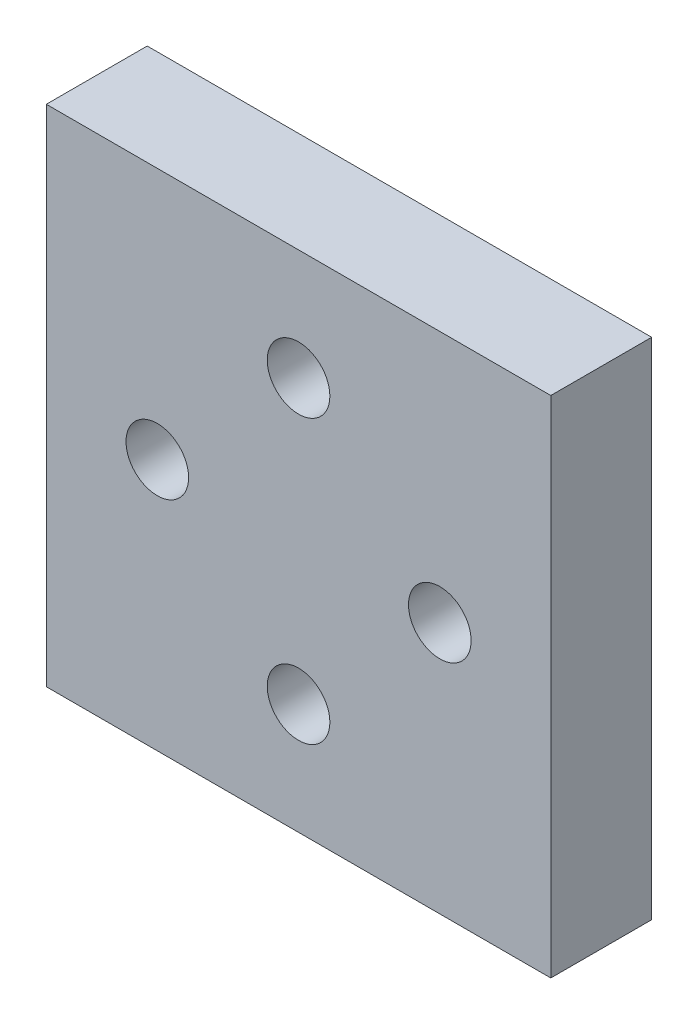
from build123d import *

# Parameters (mm, degrees)
SKETCH1_W           = 25
SKETCH1_H           = 25
SKETCH1_R           = 1.5
SKETCH1_R_2         = 1.551537049
BOSS_EXTRUDE1_DEPTH = 5
SKETCH2_R           = 1.55
BOSS_EXTRUDE2_DEPTH = 5


with BuildPart() as part:
    # Sketch1 → Boss-Extrude1 (new body)
    with BuildSketch(Plane.XY):
        Rectangle(SKETCH1_W, SKETCH1_H)
        Circle(SKETCH1_R, mode=Mode.SUBTRACT)
        with Locations((0, 7)):
            Circle(SKETCH1_R_2, mode=Mode.SUBTRACT)
        with Locations((7, 0)):
            Circle(SKETCH1_R_2, mode=Mode.SUBTRACT)
        with Locations((0, -7)):
            Circle(SKETCH1_R_2, mode=Mode.SUBTRACT)
        with Locations((-7, 0)):
            Circle(SKETCH1_R_2, mode=Mode.SUBTRACT)
    extrude(amount=BOSS_EXTRUDE1_DEPTH)

    # Sketch2 → Boss-Extrude2 (add)
    with BuildSketch(Plane.XY.offset(5)):
        Circle(SKETCH2_R)
    extrude(amount=-BOSS_EXTRUDE2_DEPTH)


solid = part.part
